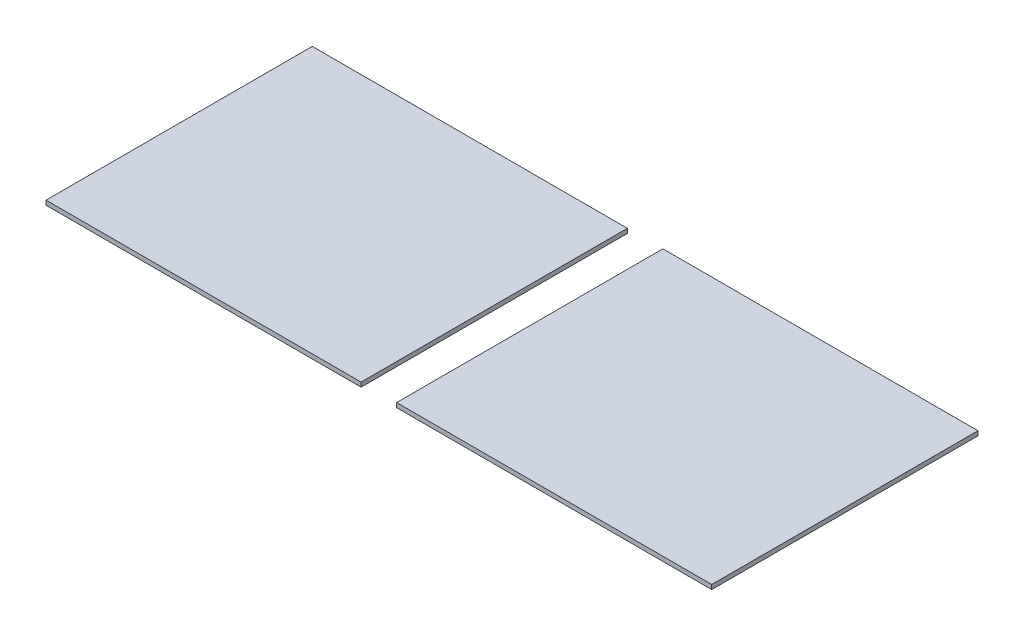
from build123d import *

# Parameters (mm, degrees)
SKETCH1_W           = 1219.2
SKETCH1_H           = 609.6
BOSS_EXTRUDE1_DEPTH = 6.35
CUT_EXTRUDE1_REACH  = 1365.122


with BuildPart() as part:
    # Sketch1 → Boss-Extrude1 (new body)
    with BuildSketch(Plane(origin=(0, 0, 0), x_dir=(1, 0, 0), z_dir=(0, 1, 0))):
        with Locations((609.6, 304.8)):
            Rectangle(SKETCH1_W, SKETCH1_H)
    extrude(amount=BOSS_EXTRUDE1_DEPTH)

    # Sketch7 → Cut-Extrude1 (cut, up to next)
    with BuildSketch(Plane(origin=(0, 6.35, 0), x_dir=(1, 0, 0), z_dir=(0, 1, 0)), mode=Mode.PRIVATE) as cut_extrude1_sk1:
        Polygon((501.65, 381), (952.5, 381), (952.5, 0), (1219.2, 0), (1219.2, 381), (1219.2, 609.6), (0, 609.6), (0, 381), (450.85, 381), (450.85, 0), (501.65, 0), align=None)
    cut_extrude1_tool1 = extrude(cut_extrude1_sk1.sketch, amount=-CUT_EXTRUDE1_REACH, mode=Mode.PRIVATE) & part.part
    add(cut_extrude1_tool1.solids().sort_by_distance((724.222881, 6.35, -403.048184))[0], mode=Mode.SUBTRACT)


with BuildPart() as cut_extrude1_piece_1:
    # of the separate pieces the step leaves, piece 1, a body of its own (cut_extrude1_pieces)
    add(part.part.solids().sort_by_distance((0, 0, 0))[0])


with BuildPart() as cut_extrude1_piece_2:
    # of the separate pieces the step leaves, piece 2, a body of its own (cut_extrude1_pieces)
    add(part.part.solids().sort_by_distance((501.65, 0, 0))[0])


solid = Compound([cut_extrude1_piece_1.part, cut_extrude1_piece_2.part])
